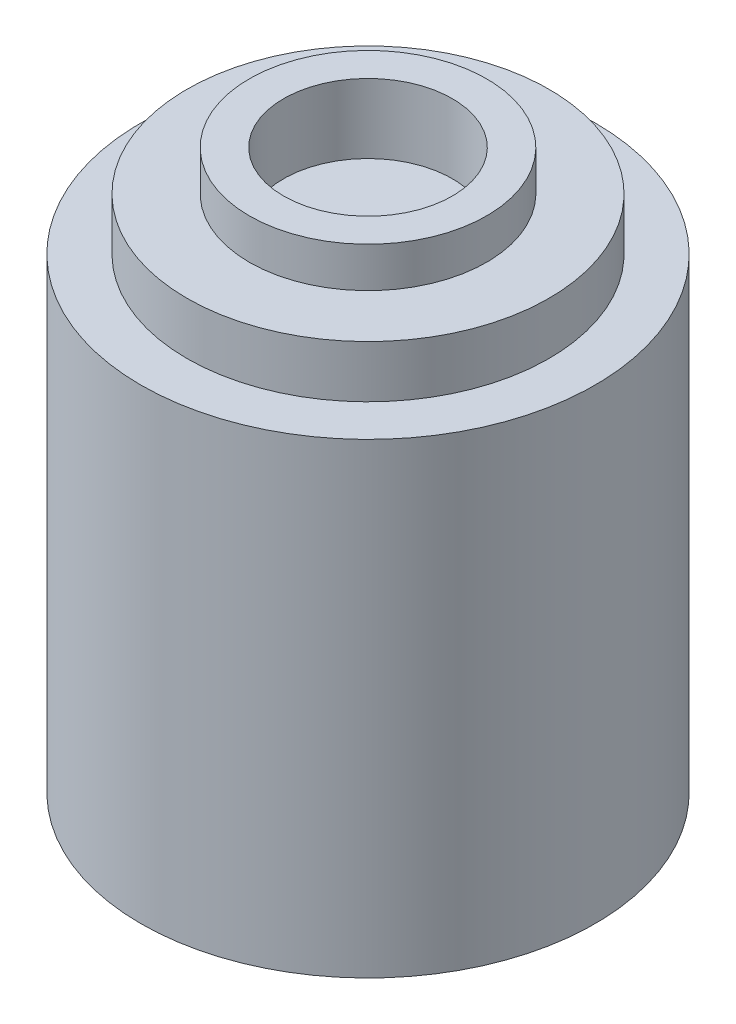
from build123d import *

# Parameters (mm, degrees)
SKETCH_5_R          = 37
EXTRUDE_1_DEPTH     = 76
EXTRUDE_2_REACH     = 101.389
SKETCH_4_R          = 29.5
EXTRUDE_3_REACH     = 107.015
SKETCH_1_R          = 19.34
SKETCH_2_R          = 13.75
CUT_EXTRUDE_1_DEPTH = 11.3
SKETCH_7_R          = 35.5
SKETCH_7_R_2        = 17
CUT_EXTRUDE_2_DEPTH = 9


with BuildPart() as part:
    # Эскиз5 → Бобышка-Вытянуть1 (new body)
    with BuildSketch(Plane(origin=(0, -15.05, 0), x_dir=(1, 0, 0), z_dir=(0, 1, 0))):
        with Locations(Location((0, 0, 0), (0, 0, 270))):
            Circle(SKETCH_5_R)
    extrude(amount=-EXTRUDE_1_DEPTH)

    # Эскиз4 → Бобышка-Вытянуть2 (add, up to next)
    with BuildSketch(Plane(origin=(0, -6.55, 0), x_dir=(1, 0, 0), z_dir=(0, 1, 0)), mode=Mode.PRIVATE) as extrude_2_sk1:
        with Locations(Location((0, 0, 0), (0, 0, 270))):
            Circle(SKETCH_4_R)
    extrude_2_tool1 = extrude(extrude_2_sk1.sketch, amount=-EXTRUDE_2_REACH, mode=Mode.PRIVATE) - part.part
    add(extrude_2_tool1.solids().sort_by_distance((0, -6.55, 0))[0])

    # Эскиз1 → Бобышка-Вытянуть3 (add, up to next)
    with BuildSketch(Plane(origin=(0, 0, 0), x_dir=(1, 0, 0), z_dir=(0, 1, 0)), mode=Mode.PRIVATE) as extrude_3_sk1:
        with Locations(Location((0, 0, 0), (0, 0, 270))):
            Circle(SKETCH_1_R)
    extrude_3_tool1 = extrude(extrude_3_sk1.sketch, amount=-EXTRUDE_3_REACH, mode=Mode.PRIVATE) - part.part
    add(extrude_3_tool1.solids().sort_by_distance((0, 0, 0))[0])

    # Эскиз2 → Вырез-Вытянуть1 (cut)
    with BuildSketch(Plane(origin=(0, -11.3, 0), x_dir=(1, 0, 0), z_dir=(0, 1, 0))):
        with Locations(Location((0, 0, 0), (0, 0, 270))):
            Circle(SKETCH_2_R)
    extrude(amount=CUT_EXTRUDE_1_DEPTH, mode=Mode.SUBTRACT)

    # Эскиз7 → Вырез-Вытянуть2 (cut)
    with BuildSketch(Plane.XZ.offset(91.05)):
        with Locations(Location((0, 0, 0), (0, 0, 270))):
            Circle(SKETCH_7_R)
        with Locations(Location((0, 0, 0), (0, 0, 270))):
            Circle(SKETCH_7_R_2, mode=Mode.SUBTRACT)
    extrude(amount=-CUT_EXTRUDE_2_DEPTH, mode=Mode.SUBTRACT)


solid = part.part
